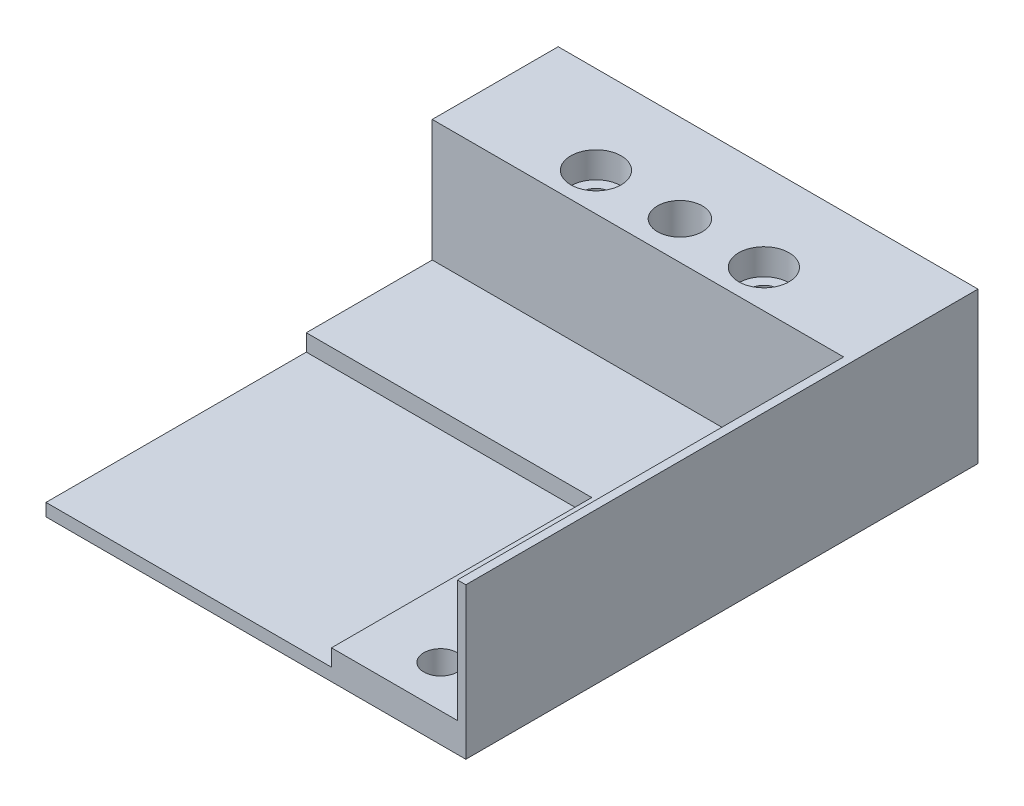
from build123d import *

# Parameters (mm, degrees)
OUTLINESKETCH2_W                               = 50
OUTLINESKETCH2_H                               = 61
OUTLINESKETCH2_R                               = 2
OUTLINEBOSS_EXTRUDE1_DEPTH                     = 18
BUILDPLATECUTOUTSKETCH1_W                      = 49
BUILDPLATECUTOUTSKETCH1_H                      = 46
BUILDPLATECUTOUTCUT_EXTRUDE7_DEPTH             = 14.5
HEATMATCUTSKETCH3_W                            = 34
HEATMATCUTSKETCH3_H                            = 31
HEATMATCUT_EXTRUDE8_DEPTH                      = 2
SKETCH1_R                                      = 1.75
SKETCH1_R_2                                    = 2.675
ZENDSTOPSWITCHMOUNTHOLESCUT_EXTRUDE1_DEPTH     = 81.901174281
SKETCH3_R                                      = 3
ZENDSTOPSWITCHMOUNTBOREHOLESCUT_EXTRUDE2_DEPTH = 3.1
SKETCH4_R                                      = 4.125
ZENDSTOPSWITCHCONNINGTOWERTBORECUT_EXTRU_DEPTH = 7.5


with BuildPart() as part:
    # OutlineSketch2 → OutlineBoss-Extrude1 (new body)
    with BuildSketch(Plane(origin=(0, 0, 0), x_dir=(1, 0, 0), z_dir=(0, 1, 0))):
        with Locations((25, 30.5)):
            Rectangle(OUTLINESKETCH2_W, OUTLINESKETCH2_H)
        with Locations(Location((42, 5, 0), (0, 0, 270))):
            Circle(OUTLINESKETCH2_R, mode=Mode.SUBTRACT)
    extrude(amount=OUTLINEBOSS_EXTRUDE1_DEPTH)

    # BuildPlateCutoutSketch1 → BuildPlateCutoutCut-Extrude7 (cut)
    with BuildSketch(Plane(origin=(0, 18, 0), x_dir=(1, 0, 0), z_dir=(0, 1, 0))):
        with Locations((24.5, 23)):
            Rectangle(BUILDPLATECUTOUTSKETCH1_W, BUILDPLATECUTOUTSKETCH1_H)
    extrude(amount=-BUILDPLATECUTOUTCUT_EXTRUDE7_DEPTH, mode=Mode.SUBTRACT)

    # HeatMatCutSketch3 → HeatMatCut-Extrude8 (cut)
    with BuildSketch(Plane(origin=(0, 3.5, 0), x_dir=(1, 0, 0), z_dir=(0, 1, 0))):
        with Locations((17, 15.5)):
            Rectangle(HEATMATCUTSKETCH3_W, HEATMATCUTSKETCH3_H)
    extrude(amount=-HEATMATCUT_EXTRUDE8_DEPTH, mode=Mode.SUBTRACT)

    # Sketch1 → ZEndStopSwitchMountHolesCut-Extrude1 (cut, through all)
    with BuildSketch(Plane(origin=(0, 18, 0), x_dir=(1, 0, 0), z_dir=(0, 1, 0))):
        with Locations(Location((35, 50.5, 0), (0, 0, 270))):
            Circle(SKETCH1_R)
        with Locations(Location((25, 50.5, 0), (0, 0, 270))):
            Circle(SKETCH1_R_2)
        with Locations(Location((15, 50.5, 0), (0, 0, 270))):
            Circle(SKETCH1_R)
    extrude(amount=-ZENDSTOPSWITCHMOUNTHOLESCUT_EXTRUDE1_DEPTH, mode=Mode.SUBTRACT)

    # Sketch3 → ZEndStopSwitchMountBoreHolesCut-Extrude2 (cut)
    with BuildSketch(Plane(origin=(0, 18, 0), x_dir=(1, 0, 0), z_dir=(0, 1, 0))):
        with Locations(Location((35, 50.5, 0), (0, 0, 270))):
            Circle(SKETCH3_R)
        with Locations(Location((15, 50.5, 0), (0, 0, 270))):
            Circle(SKETCH3_R)
    extrude(amount=-ZENDSTOPSWITCHMOUNTBOREHOLESCUT_EXTRUDE2_DEPTH, mode=Mode.SUBTRACT)

    # Sketch4 → ZEndStopSwitchConningTowertBoreCut-Extrude1 (cut)
    with BuildSketch(Plane.XZ):
        with Locations(Location((25, -50.5, 0), (0, 0, 270))):
            Circle(SKETCH4_R)
    extrude(amount=-ZENDSTOPSWITCHCONNINGTOWERTBORECUT_EXTRU_DEPTH, mode=Mode.SUBTRACT)


solid = part.part
